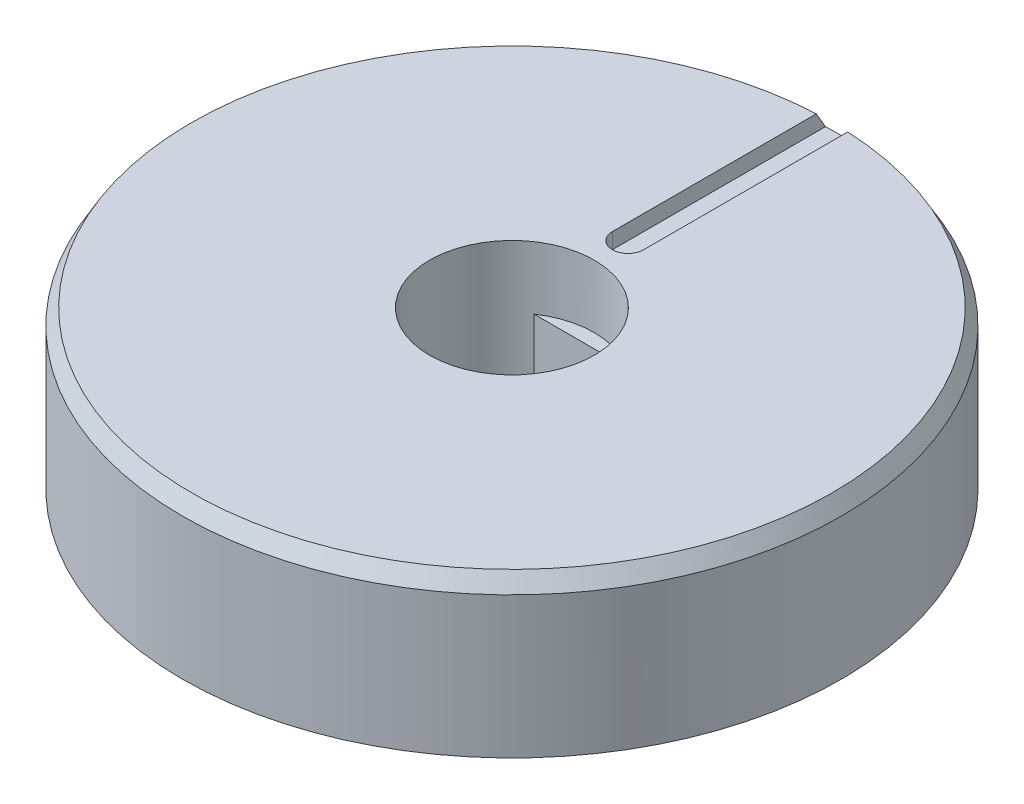
from build123d import *
from build123d.topology import SkipClean

# Parameters (mm, degrees)
SKETCH1_R           = 10.5
SKETCH1_R_2         = 8.6
BOSS_EXTRUDE1_DEPTH = 4
BOSS_EXTRUDE2_DEPTH = 1.25
BOSS_EXTRUDE3_START = 17.2
BOSS_EXTRUDE3_DEPTH = 1.25
BOSS_EXTRUDE4_START = 1
SKETCH3_R           = 10.5
BOSS_EXTRUDE4_DEPTH = 1
SKETCH5_R           = 3.125
BOSS_EXTRUDE5_DEPTH = 9
FILLET2_R           = 0.75
CUT_EXTRUDE1_DEPTH  = 5.25
FILLET1_R           = 0.25
SKETCH7_R           = 2.625
CUT_EXTRUDE2_DEPTH  = 2
CUT_EXTRUDE3_DEPTH  = 0.5
CUT_EXTRUDE4_DEPTH  = 4
CHAMFER2_SIZE       = 0.25
CHAMFER3_SIZE       = 0.5
CHAMFER3_SIZE2      = 0.288675135


with BuildPart() as part:
    # Sketch1 → Boss-Extrude1 (new body)
    with BuildSketch(Plane(origin=(0, 0, 0), x_dir=(1, 0, 0), z_dir=(0, 1, 0))):
        with Locations(Location((0, 0, 0), (0, 0, 270))):
            Circle(SKETCH1_R)
        with Locations(Location((0, 0, 0), (0, 0, 270))):
            Circle(SKETCH1_R_2, mode=Mode.SUBTRACT)
    extrude(amount=-BOSS_EXTRUDE1_DEPTH)

    # Sketch2 → Boss-Extrude2 (add)
    with BuildSketch(Plane(origin=(0, 0, 8.6), x_dir=(-1, 0, 0), z_dir=(0, 0, -1))):
        Polygon((0.4, -3.75), (-0.4, -3.75), (-0.4, -1.9), (-2.3, 0), (2.3, 0), (0.4, -1.9), align=None)
    extrude(amount=BOSS_EXTRUDE2_DEPTH)

    # Sketch2<2> → Boss-Extrude3 (add)
    with BuildSketch(Plane(origin=(0, 0, 8.6), x_dir=(-1, 0, 0), z_dir=(0, 0, -1)).offset(BOSS_EXTRUDE3_START)):
        Polygon((0.4, -3.75), (-0.4, -3.75), (-0.4, -1.9), (-2.3, 0), (2.3, 0), (0.4, -1.9), align=None)
    extrude(amount=-BOSS_EXTRUDE3_DEPTH)

    # Sketch3 → Boss-Extrude4 (add)
    with BuildSketch(Plane(origin=(0, 0, 0), x_dir=(1, 0, 0), z_dir=(0, 1, 0)).offset(BOSS_EXTRUDE4_START)):
        with Locations(Location((0, 0, 0), (0, 0, 270))):
            Circle(SKETCH3_R)
    extrude(amount=-BOSS_EXTRUDE4_DEPTH)

    # Sketch5 → Boss-Extrude5 (add)
    with BuildSketch(Plane.XZ):
        with Locations(Location((0, 0, 0), (0, 0, 90))):
            Circle(SKETCH5_R)
    extrude(amount=BOSS_EXTRUDE5_DEPTH)

    # Fillet2
    fillet2_edges = [part.edges().sort_by_distance(p)[0] for p in [
        (0, 0, -3.125),
    ]]
    fillet(fillet2_edges, radius=FILLET2_R)

    # Sketch4 → Cut-Extrude1 (cut)
    with BuildSketch(Plane(origin=(0, 1, 0), x_dir=(1, 0, 0), z_dir=(0, 1, 0))):
        with BuildLine():
            Line((-1.469693846, 2.175), (1.469693846, 2.175))
            ThreePointArc((1.469693846, 2.175), (0, -2.625), (-1.469693846, 2.175))
        make_face()
    extrude(amount=-CUT_EXTRUDE1_DEPTH, mode=Mode.SUBTRACT)

    # Fillet1
    fillet1_edges = [part.edges().sort_by_distance(p)[0] for p in [
        (-0.4, -3.75, 7.970346319),
        (0.4, -3.75, 7.970346319),
        (-0.4, -3.75, -7.970346319),
        (0.4, -3.75, -7.970346319),
    ]]
    fillet(fillet1_edges, radius=FILLET1_R)

    # Sketch7 → Cut-Extrude2 (cut)
    with SkipClean():  # the faces are left unmerged after this step: merging them gives an invalid solid
        with BuildSketch(Plane(origin=(0, 1, 0), x_dir=(1, 0, 0), z_dir=(0, 1, 0))):
            with Locations(Location((0, 0, 0), (0, 0, 270))):
                Circle(SKETCH7_R)
        extrude(amount=-CUT_EXTRUDE2_DEPTH, mode=Mode.SUBTRACT)

    # Sketch9 → Cut-Extrude3 (cut)
    with SkipClean():  # the faces are left unmerged after this step: merging them gives an invalid solid
        with BuildSketch(Plane(origin=(0, 1, 0), x_dir=(1, 0, 0), z_dir=(0, 1, 0))):
            with BuildLine():
                Line((-0.5, 3.7), (-0.5, 13.7))
                ThreePointArc((-0.5, 13.7), (0, 14.2), (0.5, 13.7))
                Line((0.5, 13.7), (0.5, 3.7))
                ThreePointArc((0.5, 3.7), (0, 3.2), (-0.5, 3.7))
            make_face()
        extrude(amount=-CUT_EXTRUDE3_DEPTH, mode=Mode.SUBTRACT)

    # Sketch10 → Cut-Extrude4 (cut)
    with SkipClean():  # the faces are left unmerged after this step: merging them gives an invalid solid
        with BuildSketch(Plane.XZ.offset(9)):
            Polygon((1.804219591, 0), (0.902109796, 1.5625), (-0.902109796, 1.5625), (-1.804219591, 0), (-0.902109796, -1.5625), (0.902109796, -1.5625), align=None)
        extrude(amount=-CUT_EXTRUDE4_DEPTH, mode=Mode.SUBTRACT)

    # Chamfer2
    chamfer2_edges = [part.edges().sort_by_distance(p)[0] for p in [
        (1.353164693, -9, -0.78125),
        (1.353164693, -9, 0.78125),
        (0, -9, 1.5625),
        (-1.353164693, -9, 0.78125),
        (-1.353164693, -9, -0.78125),
        (0, -9, -1.5625),
    ]]
    chamfer(chamfer2_edges, length=CHAMFER2_SIZE)

    # Chamfer3
    chamfer3_edges = [part.edges().sort_by_distance(p)[0] for p in [
        (-10.497021698, 1, 0.250070932),
    ]]
    chamfer3_side = [part.faces().sort_by_distance(p)[0] for p in [
        (0, -1.5, -10.5),
    ]]
    chamfer(chamfer3_edges, length=CHAMFER3_SIZE, length2=CHAMFER3_SIZE2, reference=chamfer3_side[0])


solid = part.part
